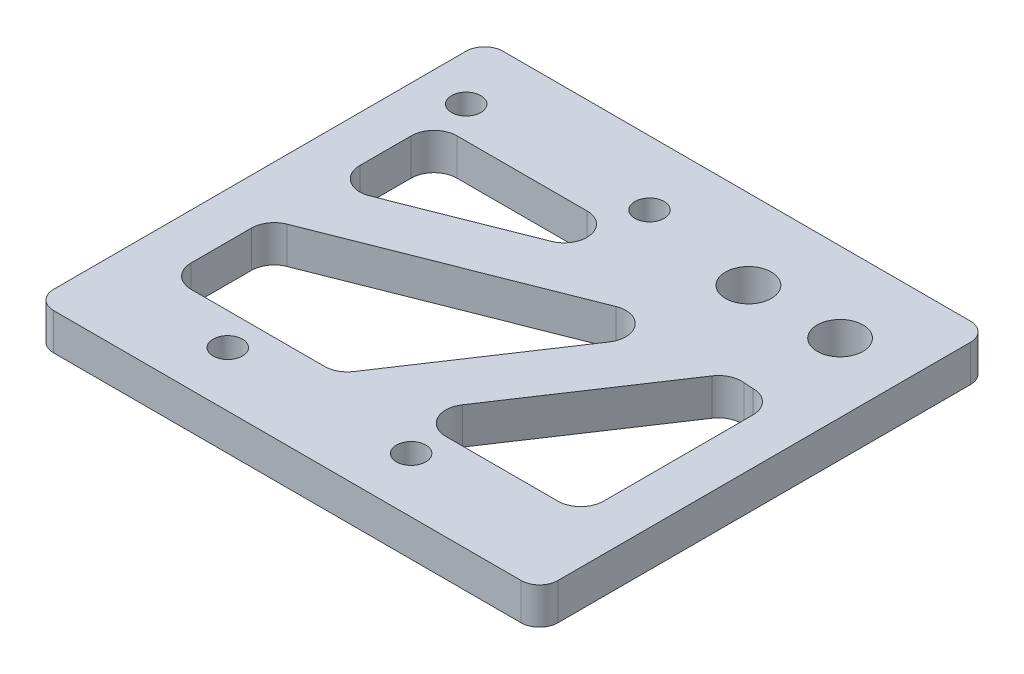
from build123d import *

# Parameters (mm, degrees)
SKETCH_1_W          = 40
SKETCH_1_H          = 49
EXTRUDE_1_DEPTH     = 4
SKETCH_3_R          = 1.6
CUT_EXTRUDE_1_DEPTH = 4
SKETCH_5_W          = 15
SKETCH_5_H          = 49
SKETCH_5_R          = 2.5
EXTRUDE_2_DEPTH     = 4
CUT_EXTRUDE_2_DEPTH = 10
EXTRUDE_2_2_DEPTH   = 4
SKETCH_10_R         = 2.5
CUT_EXTRUDE_4_DEPTH = 4
FILLET_3_R          = 2.5
FILLET_4_R          = 2
SKETCH_11_R         = 2.5
CUT_EXTRUDE_5_DEPTH = 10


with BuildPart() as part:
    # 草图1 → 凸台-拉伸1 (new body)
    with BuildSketch(Plane(origin=(0, 0, 0), x_dir=(1, 0, 0), z_dir=(0, 1, 0))):
        Rectangle(SKETCH_1_W, SKETCH_1_H)
    extrude(amount=EXTRUDE_1_DEPTH)

    # 草图3 → 切除-拉伸1 (cut)
    with BuildSketch(Plane(origin=(0, 4, 0), x_dir=(1, 0, 0), z_dir=(0, 1, 0))):
        with Locations(Location((-5, -18.5, 0), (0, 0, 270))):
            Circle(SKETCH_3_R)
        with Locations(Location((15, -18.5, 0), (0, 0, 270))):
            Circle(SKETCH_3_R)
        with Locations(Location((-15, 17.5, 0), (0, 0, 270))):
            Circle(SKETCH_3_R)
        with Locations(Location((5, 17.5, 0), (0, 0, 270))):
            Circle(SKETCH_3_R)
    extrude(amount=-CUT_EXTRUDE_1_DEPTH, mode=Mode.SUBTRACT)

    # 草图5 → Extrude 2 (add)
    with BuildSketch(Plane.XZ):
        with Locations((27.5, 0)):
            Rectangle(SKETCH_5_W, SKETCH_5_H)
        with Locations(Location((27.5, -15.781639971, 0), (0, 0, 270))):
            Circle(SKETCH_5_R, mode=Mode.SUBTRACT)
    extrude(amount=-EXTRUDE_2_DEPTH)

    # 草图6 → 切除-拉伸2 (cut)
    with BuildSketch(Plane.XZ):
        with BuildLine():
            Line((30, 15), (-15, 15))
            Line((-15, 15), (-15, -14))
            Line((-15, -14), (18.168560721, -14))
            ThreePointArc((18.168560721, -14), (22.470467132, -7.722247989), (30, -6.616488581))
            Line((30, -6.616488581), (30, 15))
        make_face()
    extrude(amount=-CUT_EXTRUDE_2_DEPTH, mode=Mode.SUBTRACT)

    # 草图8 → Extrude 2 2 (add)
    with BuildSketch(Plane.XZ):
        Polygon((-18.101802033, -1.000622031), (-16.101802033, -1.790346265), (35.304944651, -22.088923087), (9.496940315, 16.662915832), (8.164977494, 18.662915832), (3.171096865, 15.337084168), (4.503059685, 13.337084168), (19.695055349, -9.474356855), (-13.898197967, 3.790346265), (-15.898197967, 4.580070499), align=None)
    extrude(amount=-EXTRUDE_2_2_DEPTH)

    # 草图10 → 切除-拉伸4 (cut)
    with BuildSketch(Plane.XZ):
        with Locations(Location((27.5, -15.781639971, 0), (0, 0, 270))):
            Circle(SKETCH_10_R)
        Polygon((35.304944651, -22.088923087), (35, -21.968511997), (35, -21.631035455), align=None)
    extrude(amount=-CUT_EXTRUDE_4_DEPTH, mode=Mode.SUBTRACT)

    # 圆角3
    fillet_3_edges = [part.edges().sort_by_distance(p)[0] for p in [
        (30, 2, -6.616488581),
        (-15, 2, -14),
        (-15, 2, 15),
        (30, 2, 15),
        (3.395588654, 2, 15),
        (10.604411346, 2, 15),
        (-15, 2, 4.225406148),
        (-15, 2, -2.225406148),
        (14.819507483, 2, -14),
        (25.000500065, 2, -6.616352192),
        (19.695055349, 2, -9.474356855),
    ]]
    fillet(fillet_3_edges, radius=FILLET_3_R)

    # 圆角4
    fillet_4_edges = [part.edges().sort_by_distance(p)[0] for p in [
        (35, 2, 24.5),
        (35, 2, -24.5),
        (-20, 2, 24.5),
        (-20, 2, -24.5),
    ]]
    fillet(fillet_4_edges, radius=FILLET_4_R)

    # 草图11 → 切除-拉伸5 (cut)
    with BuildSketch(Plane.XZ):
        with Locations(Location((17.5, -15.781639971, 0), (0, 0, 270))):
            Circle(SKETCH_11_R)
    extrude(amount=-CUT_EXTRUDE_5_DEPTH, mode=Mode.SUBTRACT)


solid = part.part
